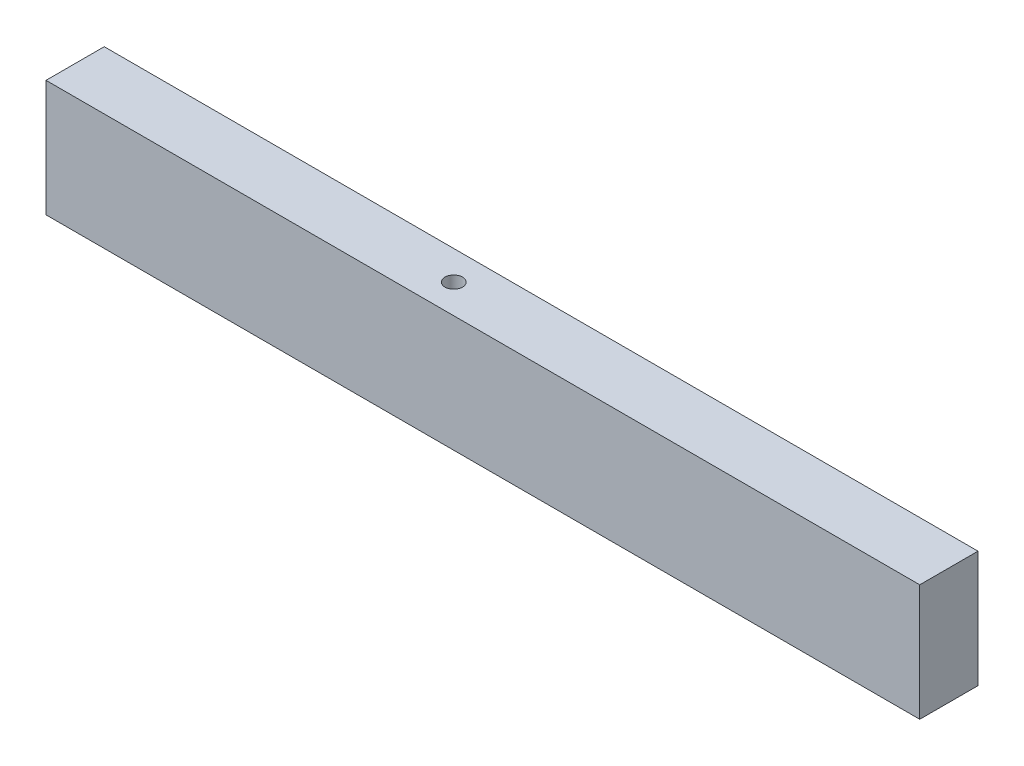
from build123d import *

# Parameters (mm, degrees)
SKIZZE1_W                       = 20
SKIZZE1_H                       = 40
AUFSATZ_LINEAR_AUSTRAGEN1_DEPTH = 300
SKIZZE2_R                       = 3
SCHNITT_LINEAR_AUSTRAGEN1_DEPTH = 303.820078595


with BuildPart() as part:
    # Skizze1 → Aufsatz-Linear austragen1 (new body)
    with BuildSketch(Plane(origin=(0, 0, 0), x_dir=(0, 0, -1), z_dir=(1, 0, 0))):
        Rectangle(SKIZZE1_W, SKIZZE1_H)
    extrude(amount=AUFSATZ_LINEAR_AUSTRAGEN1_DEPTH)

    # Skizze2 → Schnitt-Linear austragen1 (cut, through all)
    with BuildSketch(Plane(origin=(0, 20, 0), x_dir=(1, 0, 0), z_dir=(0, 1, 0))):
        with Locations(Location((130, 0, 0), (0, 0, 270))):
            Circle(SKIZZE2_R)
    extrude(amount=-SCHNITT_LINEAR_AUSTRAGEN1_DEPTH, mode=Mode.SUBTRACT)


solid = part.part
